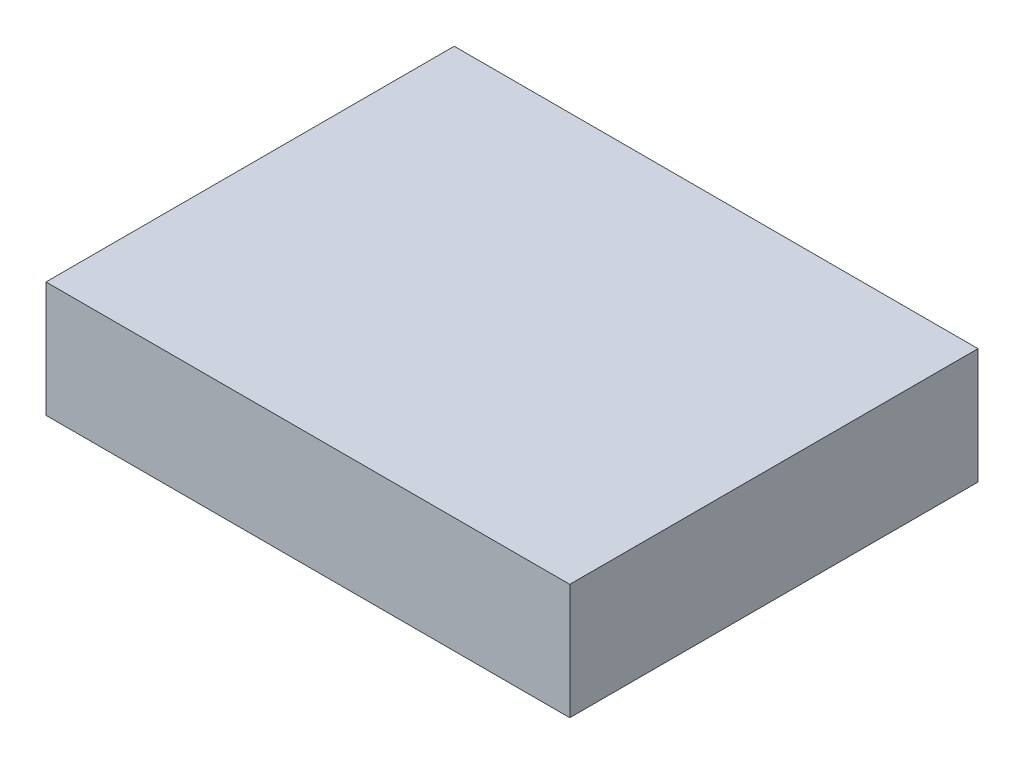
from build123d import *

# Parameters (mm, degrees)
SKETCH1_W           = 68
SKETCH1_H           = 53
BOSS_EXTRUDE1_DEPTH = 15


with BuildPart() as part:
    # Sketch1 → Boss-Extrude1 (new body)
    with BuildSketch(Plane(origin=(0, 0, 0), x_dir=(1, 0, 0), z_dir=(0, 1, 0))):
        Rectangle(SKETCH1_W, SKETCH1_H)
    extrude(amount=BOSS_EXTRUDE1_DEPTH)


solid = part.part
